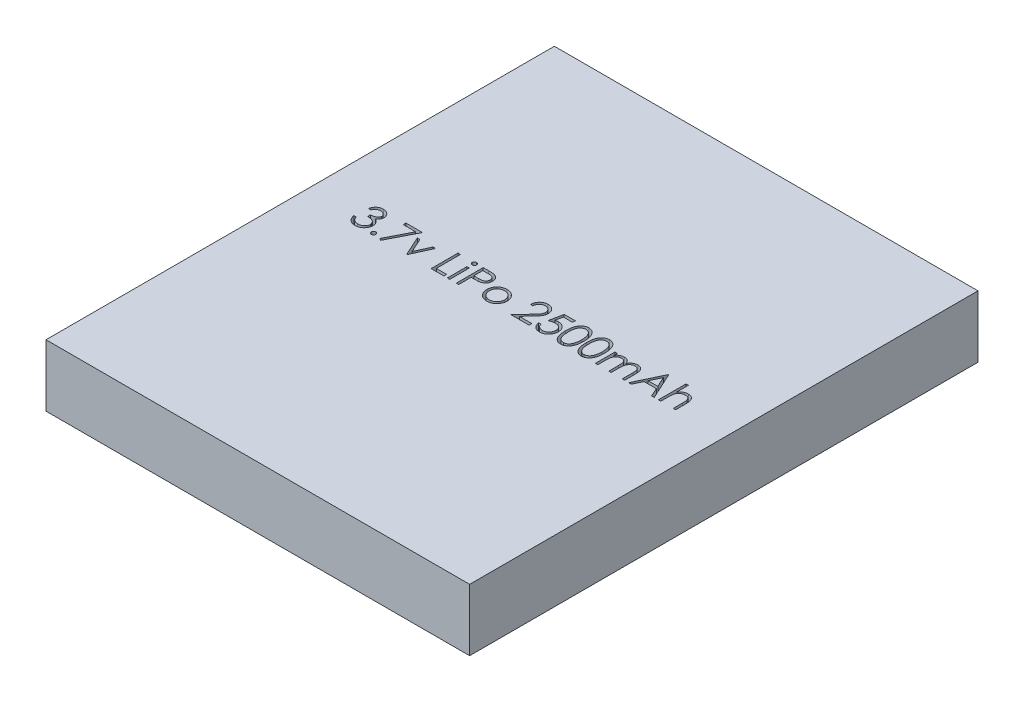
from build123d import *

# Parameters (mm, degrees)
SKETCH1_W           = 50
SKETCH1_H           = 60
BOSS_EXTRUDE1_DEPTH = 7.3
SKETCH2_W           = 0.284935897
SKETCH2_H           = 2.320192308
CUT_EXTRUDE4_DEPTH  = 1


with BuildPart() as part:
    # Sketch1 → Boss-Extrude1 (new body)
    with BuildSketch(Plane(origin=(0, 0, 0), x_dir=(1, 0, 0), z_dir=(0, 1, 0))):
        with Locations((25, 30)):
            Rectangle(SKETCH1_W, SKETCH1_H)
    extrude(amount=BOSS_EXTRUDE1_DEPTH)

    # Sketch2 → Cut-Extrude4 (cut)
    # profile 1 of 16: a face of its own
    with BuildSketch(Plane(origin=(0, 7.3, 0), x_dir=(1, 0, 0), z_dir=(0, 1, 0))):
        with BuildLine():
            Line((5.888942308, 32.442307692), (5.60400641, 32.442307692))
            add(Edge.make_bspline(
                [(5.60400641, 32.442307692), (5.611725788, 32.474268588), (5.626816541, 32.536749526), (5.658292197, 32.62601897), (5.692581521, 32.710495307), (5.733755923, 32.788596746), (5.778667436, 32.861892893), (5.830123048, 32.928721313), (5.885748796, 32.990781646), (5.947275715, 33.045857226), (6.011799572, 33.09572988), (6.080229548, 33.138252254), (6.151188888, 33.174832021), (6.22516923, 33.204967517), (6.302390828, 33.227669242), (6.382155558, 33.244140059), (6.464672447, 33.254836284), (6.520686333, 33.25588019), (6.549128606, 33.256410256)],
                knots=[0, 0, 0, 0, 1.162005537, 2.271625781, 3.343758855, 4.383309926, 5.390229558, 6.379919256, 7.361854164, 8.333198761, 9.295911338, 10.242430842, 11.177959212, 12.116337295, 13.062827104, 14.020064771, 14.994644689, 16, 16, 16, 16], degree=3))
            add(Edge.make_bspline(
                [(6.549128606, 33.256410256), (6.590569379, 33.255159098), (6.672546982, 33.252684071), (6.792982031, 33.230083118), (6.909120646, 33.194318891), (7.019691606, 33.144903438), (7.122396899, 33.083954947), (7.213779011, 33.011415507), (7.292599303, 32.928684712), (7.358724917, 32.837305886), (7.410500095, 32.73964696), (7.448678448, 32.639135389), (7.471920973, 32.5360096), (7.474933192, 32.466379783), (7.476442308, 32.431495393)],
                knots=[0, 0, 0, 0, 1.083050992, 2.142477498, 3.193116406, 4.255571735, 5.30263384, 6.308962982, 7.297363603, 8.282367274, 9.249857812, 10.179914175, 11.08814088, 12, 12, 12, 12], degree=3))
            add(Edge.make_bspline(
                [(7.476442308, 32.431495393), (7.475386764, 32.397924943), (7.47332123, 32.332232783), (7.455782797, 32.236328282), (7.426267759, 32.145939116), (7.385383045, 32.060684776), (7.332458925, 31.981105814), (7.268348693, 31.907023185), (7.192599849, 31.838108306), (7.135196813, 31.798629927), (7.10564403, 31.778305288)],
                knots=[0, 0, 0, 0, 1.024540389, 2.004866551, 2.965041327, 3.920577974, 4.882998113, 5.874504559, 6.905732034, 8, 8, 8, 8], degree=3))
            add(Edge.make_bspline(
                [(7.10564403, 31.778305288), (7.139418551, 31.761996519), (7.206335644, 31.729684128), (7.297549338, 31.666314977), (7.380351411, 31.593148148), (7.426528356, 31.53605017), (7.449729567, 31.507361779)],
                knots=[0, 0, 0, 0, 1.015518401, 2.012035669, 3.001164323, 4, 4, 4, 4], degree=3))
            add(Edge.make_bspline(
                [(7.449729567, 31.507361779), (7.465007071, 31.486445104), (7.495311898, 31.44495428), (7.532718418, 31.378246236), (7.566653829, 31.310798814), (7.593097242, 31.24080421), (7.613574964, 31.16907369), (7.62821265, 31.095484088), (7.637305978, 31.019975311), (7.638608229, 30.968891847), (7.639262821, 30.943214143)],
                knots=[0, 0, 0, 0, 1.025084078, 2.033381695, 3.024893161, 4.013698104, 4.991890475, 5.976764909, 6.982997093, 8, 8, 8, 8], degree=3))
            add(Edge.make_bspline(
                [(7.639262821, 30.943214143), (7.63763494, 30.898755324), (7.634386841, 30.810046911), (7.605354574, 30.678987699), (7.560348277, 30.550875994), (7.49643377, 30.428343818), (7.418539673, 30.313698758), (7.325868386, 30.211122392), (7.219472859, 30.122949372), (7.100813449, 30.049280094), (6.972255768, 29.990390265), (6.834755052, 29.949516727), (6.690292503, 29.922895713), (6.591225883, 29.920041054), (6.540860377, 29.918589744)],
                knots=[0, 0, 0, 0, 0.955779014, 1.907060117, 2.875433937, 3.871313158, 4.872415639, 5.851225146, 6.836215519, 7.83643374, 8.849228613, 9.86973379, 10.916971861, 12, 12, 12, 12], degree=3))
            add(Edge.make_bspline(
                [(6.540860377, 29.918589744), (6.506915726, 29.919377337), (6.440123972, 29.920927058), (6.341931655, 29.931521218), (6.248204114, 29.95087058), (6.158814621, 29.976908578), (6.073683767, 30.009921087), (5.993071329, 30.05103162), (5.916481354, 30.099392769), (5.844636591, 30.155575381), (5.777545605, 30.218423453), (5.716991348, 30.289052698), (5.66196425, 30.366157486), (5.613937713, 30.450633401), (5.570724192, 30.541388741), (5.535181467, 30.639585593), (5.50389813, 30.744346099), (5.489353487, 30.817350906), (5.481891026, 30.854807692)],
                knots=[0, 0, 0, 0, 1.048658725, 2.063410685, 3.046034179, 4.001477787, 4.936774919, 5.862367409, 6.792675028, 7.730719943, 8.675894397, 9.627829632, 10.600096036, 11.597688215, 12.626045268, 13.701542398, 14.82072376, 16, 16, 16, 16], degree=3))
            Line((5.481891026, 30.854807692), (5.766826923, 30.854807692))
            add(Edge.make_bspline(
                [(5.766826923, 30.854807692), (5.774250337, 30.830361087), (5.788689523, 30.782810317), (5.813267922, 30.714375183), (5.841269855, 30.651638949), (5.87130949, 30.594141403), (5.902858509, 30.541316295), (5.938159905, 30.494560456), (5.974599058, 30.451820237), (6.002066757, 30.427740482), (6.015509816, 30.415955529)],
                knots=[0, 0, 0, 0, 1.198163088, 2.33053128, 3.407730985, 4.417276592, 5.372219308, 6.28897303, 7.162600585, 8, 8, 8, 8], degree=3))
            add(Edge.make_bspline(
                [(6.015509816, 30.415955529), (6.03328671, 30.402250112), (6.068785626, 30.374881583), (6.126632521, 30.339955106), (6.187469953, 30.30969189), (6.252616122, 30.286574537), (6.320665235, 30.267000516), (6.392717202, 30.254191188), (6.468136349, 30.245402633), (6.519632821, 30.244627088), (6.545948518, 30.244230769)],
                knots=[0, 0, 0, 0, 0.946170439, 1.889420265, 2.845303464, 3.807233317, 4.801018734, 5.828864929, 6.890507805, 8, 8, 8, 8], degree=3))
            add(Edge.make_bspline(
                [(6.545948518, 30.244230769), (6.575660624, 30.244789483), (6.633760082, 30.245882), (6.71853699, 30.255929249), (6.799188746, 30.270561838), (6.8748199, 30.293161472), (6.946421146, 30.321084102), (7.012988785, 30.356143727), (7.075396682, 30.397277867), (7.132845499, 30.444031247), (7.18450321, 30.495213603), (7.229986911, 30.548746889), (7.268653568, 30.604405392), (7.299844386, 30.662497116), (7.324473813, 30.722781502), (7.341240717, 30.785427726), (7.352898877, 30.849923103), (7.353848304, 30.893764382), (7.354326923, 30.915865385)],
                knots=[0, 0, 0, 0, 1.217147791, 2.380027433, 3.494444702, 4.572153297, 5.609568379, 6.639424714, 7.649109417, 8.668170816, 9.669597737, 10.625200337, 11.543417969, 12.441394052, 13.322311151, 14.205496177, 15.095365482, 16, 16, 16, 16], degree=3))
            add(Edge.make_bspline(
                [(7.354326923, 30.915865385), (7.352938721, 30.945448528), (7.350169224, 31.004467612), (7.329025013, 31.091297126), (7.294246186, 31.174956936), (7.245557551, 31.254019688), (7.186288711, 31.327294971), (7.117014832, 31.392674101), (7.037160653, 31.446621969), (6.963664057, 31.483895251), (6.898562808, 31.509328883), (6.842850281, 31.526269744), (6.780478219, 31.540614988), (6.712200889, 31.55396112), (6.637503828, 31.565319772), (6.556468359, 31.574791991), (6.469078061, 31.582371206), (6.408579646, 31.585755843), (6.377403846, 31.5875)],
                knots=[0, 0, 0, 0, 1.07054697, 2.135767047, 3.216561865, 4.33974944, 5.486079747, 6.621378074, 7.775625952, 8.963672916, 9.598146892, 10.304877434, 11.070270905, 11.915000392, 12.823868403, 13.805723172, 14.86925407, 16, 16, 16, 16], degree=3))
            Line((6.377403846, 31.5875), (6.377403846, 31.913141026))
            add(Edge.make_bspline(
                [(6.377403846, 31.913141026), (6.416684189, 31.913807598), (6.493624732, 31.915113248), (6.606014566, 31.930904801), (6.713486785, 31.95274937), (6.813659615, 31.986209509), (6.904962376, 32.025071778), (6.98417373, 32.070294854), (7.050183928, 32.120563948), (7.102672185, 32.176654958), (7.142159414, 32.23681218), (7.171030866, 32.299510862), (7.188085448, 32.365300546), (7.190362074, 32.41019928), (7.19150641, 32.432767428)],
                knots=[0, 0, 0, 0, 1.321986639, 2.589447074, 3.816329219, 5.01088745, 6.139805852, 7.153945165, 8.075214402, 8.924034688, 9.728124013, 10.488707548, 11.240355623, 12, 12, 12, 12], degree=3))
            add(Edge.make_bspline(
                [(7.19150641, 32.432767428), (7.19113048, 32.449347954), (7.190382586, 32.482334124), (7.180950769, 32.53052615), (7.166777532, 32.577244866), (7.147292349, 32.622291594), (7.121211812, 32.665353913), (7.090000667, 32.706798956), (7.052836747, 32.746390099), (7.01025052, 32.78329296), (6.964519811, 32.818462197), (6.914400373, 32.848319567), (6.861403386, 32.873851159), (6.805470178, 32.894905493), (6.746419233, 32.910743562), (6.684527998, 32.922115361), (6.619678457, 32.929225234), (6.575435528, 32.930248868), (6.552944712, 32.930769231)],
                knots=[0, 0, 0, 0, 0.884392785, 1.759457502, 2.611959086, 3.489218968, 4.37281399, 5.2945488, 6.255912374, 7.266815255, 8.301784654, 9.332968512, 10.37626691, 11.440494194, 12.520033166, 13.637162961, 14.798855837, 16, 16, 16, 16], degree=3))
            add(Edge.make_bspline(
                [(6.552944712, 32.930769231), (6.516793556, 32.929507067), (6.44618194, 32.927041767), (6.34438698, 32.905449033), (6.249754441, 32.870997486), (6.177420079, 32.829873961), (6.124005172, 32.789278925), (6.085835378, 32.753825617), (6.048351773, 32.714425841), (6.014020337, 32.668652887), (5.979300373, 32.619606584), (5.947691378, 32.564793673), (5.9169758, 32.505643972), (5.898467772, 32.463828647), (5.888942308, 32.442307692)],
                knots=[0, 0, 0, 0, 1.472543308, 2.876219568, 4.221790263, 5.565193594, 6.249813518, 6.953379497, 7.687249741, 8.463570142, 9.283606569, 10.136032583, 11.040678096, 12, 12, 12, 12], degree=3))
        make_face()
    # profile 2 of 16: a face of its own
    with BuildSketch(Plane(origin=(0, 7.3, 0), x_dir=(1, 0, 0), z_dir=(0, 1, 0))):
        with BuildLine():
            add(Edge.make_bspline(
                [(8.433012821, 30.488461538), (8.450693227, 30.487410916), (8.485353598, 30.485351293), (8.535463378, 30.471221025), (8.580815677, 30.446130668), (8.621212785, 30.412690862), (8.654510803, 30.372145511), (8.680495322, 30.327154936), (8.694502502, 30.276625635), (8.696547122, 30.241764429), (8.697596154, 30.223878205)],
                knots=[0, 0, 0, 0, 1.020151414, 1.999887582, 2.974338812, 3.990962822, 5.007586832, 5.987933904, 6.967670073, 8, 8, 8, 8], degree=3))
            add(Edge.make_bspline(
                [(8.697596154, 30.223878205), (8.696511573, 30.206421756), (8.694372796, 30.171997895), (8.68052743, 30.121849711), (8.65431277, 30.076831019), (8.621442455, 30.035735508), (8.58080569, 30.002224861), (8.535356158, 29.97734797), (8.485471231, 29.962205959), (8.450712852, 29.960277104), (8.433012821, 29.959294872)],
                knots=[0, 0, 0, 0, 1.009421747, 1.99056486, 2.972319754, 3.999869655, 5.017953583, 5.993804169, 6.978383603, 8, 8, 8, 8], degree=3))
            add(Edge.make_bspline(
                [(8.433012821, 29.959294872), (8.415300035, 29.960241564), (8.380720037, 29.962089754), (8.331021314, 29.977658871), (8.285294992, 30.001991581), (8.244666139, 30.035797992), (8.211520526, 30.076619551), (8.186460357, 30.122159752), (8.171410722, 30.171854341), (8.169431452, 30.206393482), (8.168429487, 30.223878205)],
                knots=[0, 0, 0, 0, 1.022052826, 1.995314843, 2.982371812, 4.00089066, 5.028879526, 6.005146991, 6.990147033, 8, 8, 8, 8], degree=3))
            add(Edge.make_bspline(
                [(8.168429487, 30.223878205), (8.169392963, 30.241793714), (8.171274031, 30.276771546), (8.186491951, 30.326845022), (8.211326087, 30.372354963), (8.244895266, 30.412629004), (8.285285163, 30.4463632), (8.330911007, 30.470914834), (8.380839732, 30.485465779), (8.415320177, 30.487445633), (8.433012821, 30.488461538)],
                knots=[0, 0, 0, 0, 1.032775665, 2.016367738, 2.991239715, 4.008302682, 5.025365648, 6.011011707, 6.979408107, 8, 8, 8, 8], degree=3))
        make_face()
    # profile 3 of 16: a face of its own
    with BuildSketch(Plane(origin=(0, 7.3, 0), x_dir=(1, 0, 0), z_dir=(0, 1, 0))):
        Polygon((9.308173077, 33.175), (11.262019231, 33.175), (9.593108974, 29.918589744), (9.346970152, 30.054061498), (10.779917869, 32.849358974), (9.308173077, 32.849358974), align=None)
    # profile 4 of 16: a face of its own
    with BuildSketch(Plane(origin=(0, 7.3, 0), x_dir=(1, 0, 0), z_dir=(0, 1, 0))):
        Polygon((11.50625, 32.320192308), (11.81471855, 32.320192308), (12.584935897, 30.630929487), (13.355153245, 32.320192308), (13.663621795, 32.320192308), (12.605288462, 30), (12.564583333, 30), align=None)
    # profile 5 of 16: a face of its own
    with BuildSketch(Plane(origin=(0, 7.3, 0), x_dir=(1, 0, 0), z_dir=(0, 1, 0))):
        Polygon((15.454647436, 33.175), (15.739583333, 33.175), (15.739583333, 30.325641026), (16.960737179, 30.325641026), (16.960737179, 30), (15.454647436, 30), align=None)
    # profile 6 of 16: a face of its own
    with BuildSketch(Plane(origin=(0, 7.3, 0), x_dir=(1, 0, 0), z_dir=(0, 1, 0))):
        with BuildLine():
            add(Edge.make_bspline(
                [(17.508984375, 33.297115385), (17.526665783, 33.296295189), (17.561289375, 33.294689089), (17.611357554, 33.280935463), (17.656947844, 33.257622177), (17.697386216, 33.226344181), (17.732086141, 33.189560043), (17.756380071, 33.146687593), (17.771994174, 33.100370114), (17.77387972, 33.06806214), (17.774839744, 33.05161258)],
                knots=[0, 0, 0, 0, 1.055194115, 2.066272739, 3.074728998, 4.095836921, 5.109056067, 6.073838105, 7.019297344, 8, 8, 8, 8], degree=3))
            add(Edge.make_bspline(
                [(17.774839744, 33.05161258), (17.77385807, 33.03559003), (17.771917418, 33.003915346), (17.756392132, 32.958400839), (17.731879102, 32.916124096), (17.697408466, 32.879411381), (17.656941947, 32.848150675), (17.61135912, 32.824832805), (17.561288963, 32.811080395), (17.526665644, 32.809474127), (17.508984375, 32.808653846)],
                knots=[0, 0, 0, 0, 0.96129708, 1.900370562, 2.859976407, 3.87933698, 4.906634145, 5.921202961, 6.938410037, 8, 8, 8, 8], degree=3))
            add(Edge.make_bspline(
                [(17.508984375, 32.808653846), (17.491505297, 32.809442807), (17.457484555, 32.810978415), (17.408166062, 32.825102646), (17.362964504, 32.848158655), (17.322447265, 32.879206694), (17.288674161, 32.916349565), (17.264092109, 32.958375039), (17.248602679, 33.003921915), (17.246657195, 33.035592237), (17.245673077, 33.05161258)],
                knots=[0, 0, 0, 0, 1.054934014, 2.053291228, 3.073705704, 4.106921865, 5.123545215, 6.088680038, 7.033164197, 8, 8, 8, 8], degree=3))
            add(Edge.make_bspline(
                [(17.245673077, 33.05161258), (17.246635634, 33.068059851), (17.248526157, 33.100363328), (17.26410372, 33.146713822), (17.288469402, 33.189332756), (17.322469628, 33.226548745), (17.362958552, 33.257614247), (17.4081676, 33.280665637), (17.457484149, 33.294791066), (17.491505159, 33.296326509), (17.508984375, 33.297115385)],
                knots=[0, 0, 0, 0, 0.98631895, 1.937192651, 2.907499808, 3.917963147, 4.944918757, 5.95915025, 6.951458133, 8, 8, 8, 8], degree=3))
        make_face()
    # profile 7 of 16: a face of its own
    with BuildSketch(Plane(origin=(0, 7.3, 0), x_dir=(1, 0, 0), z_dir=(0, 1, 0))):
        with Locations((17.51025641, 31.160096154)):
            Rectangle(SKETCH2_W, SKETCH2_H)
    # profile 8 of 16: a face of its own
    with BuildSketch(Plane(origin=(0, 7.3, 0), x_dir=(1, 0, 0), z_dir=(0, 1, 0))):
        with BuildLine():
            Line((18.426121795, 33.175), (19.048783053, 33.175))
            add(Edge.make_bspline(
                [(19.048783053, 33.175), (19.091610089, 33.174952923), (19.173668593, 33.17486272), (19.291338679, 33.172127915), (19.398208935, 33.16847513), (19.494048924, 33.163411556), (19.579153527, 33.157427506), (19.653137649, 33.149034585), (19.716582818, 33.140271317), (19.754597954, 33.131361898), (19.771935096, 33.127298678)],
                knots=[0, 0, 0, 0, 1.415646017, 2.712440637, 3.8905458, 4.950247383, 5.884950622, 6.709939814, 7.411656543, 8, 8, 8, 8], degree=3))
            add(Edge.make_bspline(
                [(19.771935096, 33.127298678), (19.793882088, 33.121291623), (19.837258917, 33.109419063), (19.899762006, 33.085639471), (19.959228709, 33.057443507), (20.015863051, 33.025308933), (20.068969083, 32.987857028), (20.119339135, 32.946605961), (20.166528688, 32.900603324), (20.21027238, 32.850365081), (20.250445017, 32.796734605), (20.285034087, 32.738911296), (20.313996643, 32.677868471), (20.338837182, 32.613648589), (20.356715566, 32.545712367), (20.370183825, 32.474531849), (20.378732401, 32.400114666), (20.379551154, 32.349260357), (20.379967949, 32.323372396)],
                knots=[0, 0, 0, 0, 0.999701418, 1.975846123, 2.934577507, 3.890451536, 4.834027766, 5.787354733, 6.749476667, 7.726910423, 8.712836071, 9.690891519, 10.682875813, 11.679750201, 12.712814741, 13.765529915, 14.8625177, 16, 16, 16, 16], degree=3))
            add(Edge.make_bspline(
                [(20.379967949, 32.323372396), (20.379585656, 32.297266841), (20.378837675, 32.24618956), (20.369860331, 32.171465674), (20.357767943, 32.100056849), (20.339174188, 32.032121418), (20.314821327, 31.968062827), (20.286253537, 31.906902138), (20.251797048, 31.849679864), (20.212204953, 31.796188264), (20.168161721, 31.74637713), (20.119853698, 31.700607423), (20.067475912, 31.659147059), (20.01119482, 31.62190309), (19.950461743, 31.589739179), (19.886197789, 31.560930767), (19.817844379, 31.536736305), (19.77054367, 31.524009035), (19.746494391, 31.517538061)],
                knots=[0, 0, 0, 0, 1.121902311, 2.195077645, 3.232258892, 4.234102512, 5.217864754, 6.176164875, 7.132989551, 8.084763148, 9.034132444, 9.988522005, 10.94243251, 11.903244335, 12.886203696, 13.894208494, 14.929344452, 16, 16, 16, 16], degree=3))
            add(Edge.make_bspline(
                [(19.746494391, 31.517538061), (19.726603167, 31.513308071), (19.683010392, 31.504037802), (19.611216637, 31.493688702), (19.527627608, 31.484855307), (19.432357397, 31.478232132), (19.325491519, 31.472562155), (19.206972164, 31.468055384), (19.07656668, 31.465579017), (18.985606337, 31.465451298), (18.938115986, 31.465384615)],
                knots=[0, 0, 0, 0, 0.601384939, 1.31797006, 2.144135048, 3.087295005, 4.142315834, 5.309527816, 6.595305764, 8, 8, 8, 8], degree=3))
            Line((18.938115986, 31.465384615), (18.711057692, 31.465384615))
            Line((18.711057692, 31.465384615), (18.711057692, 30))
            Line((18.711057692, 30), (18.426121795, 30))
            Line((18.426121795, 30), (18.426121795, 33.175))
        make_face()
        with BuildLine():
            Line((18.711057692, 32.849358974), (18.711057692, 31.791025641))
            Line((18.711057692, 31.791025641), (19.266937099, 31.784029447))
            add(Edge.make_bspline(
                [(19.266937099, 31.784029447), (19.294078746, 31.784015419), (19.346475136, 31.783988339), (19.42216371, 31.787603506), (19.492384992, 31.791776847), (19.556923286, 31.797887291), (19.615807683, 31.806524432), (19.66913637, 31.815243652), (19.716495834, 31.827857802), (19.771921538, 31.8448423), (19.833682861, 31.873809745), (19.900872708, 31.915855716), (19.957814597, 31.969450359), (20.007089052, 32.029709891), (20.046192242, 32.096746959), (20.074818035, 32.16847378), (20.091637513, 32.244154758), (20.093892846, 32.295941855), (20.095032051, 32.322100361)],
                knots=[0, 0, 0, 0, 1.160613943, 2.240541288, 3.23993089, 4.169200891, 5.011653406, 5.7853311, 6.478053781, 7.106038997, 8.262395093, 9.384106736, 10.481365981, 11.59014053, 12.70357646, 13.786202915, 14.881775077, 16, 16, 16, 16], degree=3))
            add(Edge.make_bspline(
                [(20.095032051, 32.322100361), (20.093886651, 32.347626012), (20.091609736, 32.398367848), (20.074686203, 32.472734295), (20.046247896, 32.543705256), (20.006826557, 32.609902269), (19.958982818, 32.669944969), (19.903375557, 32.722103078), (19.840135669, 32.764032765), (19.78130906, 32.791095813), (19.729056555, 32.80761967), (19.68367042, 32.819181061), (19.632425309, 32.82841179), (19.575304537, 32.835886196), (19.512750838, 32.842284693), (19.444226795, 32.846626258), (19.36999199, 32.849167579), (19.318456687, 32.849293631), (19.291741787, 32.849358974)],
                knots=[0, 0, 0, 0, 1.120700087, 2.227813068, 3.331159281, 4.466773991, 5.599788987, 6.693661531, 7.80175334, 8.91857717, 9.525282508, 10.207424825, 10.974604443, 11.810962634, 12.737642355, 13.736264703, 14.826523623, 16, 16, 16, 16], degree=3))
            Line((19.291741787, 32.849358974), (18.711057692, 32.849358974))
        make_face(mode=Mode.SUBTRACT)
    # profile 9 of 16: a face of its own
    with BuildSketch(Plane(origin=(0, 7.3, 0), x_dir=(1, 0, 0), z_dir=(0, 1, 0))):
        with BuildLine():
            add(Edge.make_bspline(
                [(22.070502804, 32.360897436), (22.114037745, 32.359970435), (22.199399124, 32.358152812), (22.324410563, 32.338726379), (22.443740793, 32.309019841), (22.557846839, 32.267952067), (22.665267336, 32.212904869), (22.767566964, 32.147219298), (22.864465251, 32.069402231), (22.922543285, 32.009205983), (22.952023237, 31.978650841)],
                knots=[0, 0, 0, 0, 1.054011418, 2.066658804, 3.057071809, 4.030435133, 4.997543892, 5.974964718, 6.972108034, 8, 8, 8, 8], degree=3))
            add(Edge.make_bspline(
                [(22.952023237, 31.978650841), (22.977406867, 31.949428154), (23.027682883, 31.89154832), (23.092149642, 31.797699299), (23.147686343, 31.700507922), (23.192193458, 31.598683562), (23.227286301, 31.49311511), (23.252201611, 31.383439714), (23.267021545, 31.269899585), (23.269019951, 31.19278896), (23.270032051, 31.153735978)],
                knots=[0, 0, 0, 0, 1.025258237, 2.030674902, 3.01204498, 3.988269485, 4.97094183, 5.956517959, 6.965070386, 8, 8, 8, 8], degree=3))
            add(Edge.make_bspline(
                [(23.270032051, 31.153735978), (23.269141838, 31.11445664), (23.267382735, 31.036838836), (23.250742455, 30.922521268), (23.224860684, 30.811673108), (23.187820374, 30.704758435), (23.140324089, 30.601450442), (23.082366108, 30.502200351), (23.013539713, 30.406812344), (22.935521801, 30.316096391), (22.849296171, 30.232488468), (22.755755093, 30.159619252), (22.656736791, 30.097188297), (22.550924606, 30.046899549), (22.439284815, 30.007248606), (22.321576617, 29.979399306), (22.197982875, 29.962561207), (22.113593896, 29.960398966), (22.070502804, 29.959294872)],
                knots=[0, 0, 0, 0, 0.998656419, 1.973391657, 2.932242238, 3.890759089, 4.846373663, 5.82037756, 6.809684879, 7.83454468, 8.860553229, 9.859544525, 10.845671541, 11.83227036, 12.833544569, 13.85385346, 14.904124723, 16, 16, 16, 16], degree=3))
            add(Edge.make_bspline(
                [(22.070502804, 29.959294872), (22.027200595, 29.960402671), (21.942391029, 29.962572352), (21.818361031, 29.979333887), (21.700441877, 30.007235772), (21.588655934, 30.047029854), (21.482388823, 30.097189905), (21.382796786, 30.159430509), (21.28917972, 30.232510078), (21.202935848, 30.316090535), (21.124922828, 30.406813853), (21.05609517, 30.502199959), (20.998137517, 30.601450544), (20.950641147, 30.704758408), (20.913600859, 30.811673115), (20.887719082, 30.922521266), (20.871078803, 31.036838836), (20.8693197, 31.11445664), (20.868429487, 31.153735978)],
                knots=[0, 0, 0, 0, 1.099876186, 2.154163076, 3.173186993, 4.173200201, 5.163417411, 6.152872554, 7.150605724, 8.17532212, 9.198891216, 10.186952605, 11.159729845, 12.11414092, 13.071450619, 14.029093627, 15.002601286, 16, 16, 16, 16], degree=3))
            add(Edge.make_bspline(
                [(20.868429487, 31.153735978), (20.86944849, 31.192576701), (20.871465941, 31.269474659), (20.886270974, 31.38280135), (20.911089093, 31.492291124), (20.946224003, 31.597452092), (20.991141355, 31.698830237), (21.045897666, 31.796261763), (21.111022025, 31.88968641), (21.161098081, 31.94749144), (21.186438301, 31.976742788)],
                knots=[0, 0, 0, 0, 1.031353054, 2.041901799, 3.029428768, 4.008703097, 4.981709435, 5.96992636, 6.972712378, 8, 8, 8, 8], degree=3))
            add(Edge.make_bspline(
                [(21.186438301, 31.976742788), (21.215873809, 32.007562912), (21.273763914, 32.068176108), (21.371144546, 32.145766326), (21.473192512, 32.212818764), (21.581800123, 32.266772189), (21.69581243, 32.309261415), (21.815754172, 32.33880299), (21.941189818, 32.358082819), (22.026968903, 32.35994988), (22.070502804, 32.360897436)],
                knots=[0, 0, 0, 0, 1.027980169, 2.021703884, 2.998553061, 3.971491411, 4.943284454, 5.930300938, 6.949603206, 8, 8, 8, 8], degree=3))
        make_face()
        with BuildLine():
            add(Edge.make_bspline(
                [(22.069230769, 32.075961538), (22.038444508, 32.075086516), (21.977666727, 32.07335906), (21.888204675, 32.060220089), (21.802080392, 32.039403425), (21.719130484, 32.009826888), (21.639634677, 31.971637172), (21.563516862, 31.924730303), (21.490553149, 31.869727549), (21.422170848, 31.806714983), (21.359412608, 31.737881895), (21.304550444, 31.664540884), (21.257900526, 31.587881555), (21.219038382, 31.507824192), (21.190094004, 31.423557503), (21.169072762, 31.336035787), (21.155946187, 31.245080731), (21.154234972, 31.18324895), (21.153365385, 31.151827925)],
                knots=[0, 0, 0, 0, 1.021534396, 2.016698045, 2.994645724, 3.958388632, 4.93408049, 5.916473867, 6.921342795, 7.962252576, 8.998418191, 10.008913653, 10.997312074, 11.973003931, 12.956656626, 13.948281152, 14.957379055, 16, 16, 16, 16], degree=3))
            add(Edge.make_bspline(
                [(21.153365385, 31.151827925), (21.154823003, 31.111231443), (21.157716104, 31.030655018), (21.181243068, 30.911990642), (21.220600622, 30.798069962), (21.273747654, 30.689560812), (21.340337581, 30.589165246), (21.418793706, 30.499656113), (21.508274006, 30.422380413), (21.607711831, 30.358262789), (21.715076105, 30.307317867), (21.828701482, 30.271214511), (21.947211254, 30.24774519), (22.028201632, 30.245412495), (22.069230769, 30.244230769)],
                knots=[0, 0, 0, 0, 1.016792936, 2.018143844, 3.017858371, 4.030088057, 5.03801393, 6.028138512, 7.003788237, 7.991172063, 8.984598303, 9.972568034, 10.972917682, 12, 12, 12, 12], degree=3))
            add(Edge.make_bspline(
                [(22.069230769, 30.244230769), (22.110257547, 30.245419381), (22.191243266, 30.247765666), (22.309588376, 30.27109631), (22.422903194, 30.307476059), (22.530155952, 30.358205493), (22.629548514, 30.422623898), (22.71967236, 30.499219754), (22.7974586, 30.589402319), (22.863982656, 30.689693792), (22.918000058, 30.79790174), (22.957173391, 30.912011668), (22.980756916, 31.030649663), (22.983642382, 31.111229649), (22.985096154, 31.151827925)],
                knots=[0, 0, 0, 0, 1.02726834, 2.027799167, 3.010890988, 4.004497153, 4.992059811, 5.971914811, 6.958719428, 7.966827853, 8.981595046, 9.981490638, 10.983022906, 12, 12, 12, 12], degree=3))
            add(Edge.make_bspline(
                [(22.985096154, 31.151827925), (22.984226866, 31.183249138), (22.98251624, 31.245081288), (22.96938538, 31.336033657), (22.948379997, 31.423565319), (22.919377173, 31.507795351), (22.880683889, 31.588088837), (22.83313437, 31.664315804), (22.778496225, 31.738135956), (22.714980694, 31.806492473), (22.646669773, 31.869752114), (22.573676488, 31.924751631), (22.497671543, 31.971431021), (22.418406686, 32.01015354), (22.335446143, 32.039134341), (22.249442533, 32.060340285), (22.160362184, 32.073303535), (22.099802194, 32.075069871), (22.069230769, 32.075961538)],
                knots=[0, 0, 0, 0, 1.042956736, 2.052379634, 3.044323526, 4.02829302, 5.004299113, 5.996692471, 7.007513377, 8.048758398, 9.090003419, 10.095195979, 11.07790575, 12.047570684, 13.018257071, 13.989683339, 14.985167495, 16, 16, 16, 16], degree=3))
        make_face(mode=Mode.SUBTRACT)
    # profile 10 of 16: a face of its own
    with BuildSketch(Plane(origin=(0, 7.3, 0), x_dir=(1, 0, 0), z_dir=(0, 1, 0))):
        with BuildLine():
            Line((25.264583333, 32.198076923), (24.979647436, 32.198076923))
            add(Edge.make_bspline(
                [(24.979647436, 32.198076923), (24.981504496, 32.235878371), (24.985151713, 32.310119409), (25.002231661, 32.418363239), (25.026670885, 32.521827235), (25.061225276, 32.619680657), (25.104138828, 32.712788718), (25.155601067, 32.800781589), (25.216555488, 32.883323596), (25.285685883, 32.959649547), (25.360768863, 33.0296697), (25.441782108, 33.090135528), (25.526912954, 33.141223701), (25.615903123, 33.183933113), (25.709756634, 33.215991402), (25.807621798, 33.239778175), (25.909928586, 33.254089574), (25.979633463, 33.255627894), (26.015084135, 33.256410256)],
                knots=[0, 0, 0, 0, 1.10065271, 2.161652631, 3.183658789, 4.190468796, 5.17591951, 6.163126047, 7.15150782, 8.156236427, 9.156009102, 10.134482811, 11.092018607, 12.041330605, 13.001268258, 13.972401359, 14.968799086, 16, 16, 16, 16], degree=3))
            add(Edge.make_bspline(
                [(26.015084135, 33.256410256), (26.04989853, 33.255595228), (26.118307574, 33.253993726), (26.218149545, 33.240240507), (26.313197519, 33.218699863), (26.403265707, 33.188478021), (26.487635494, 33.147852148), (26.566940685, 33.099050095), (26.64212542, 33.042607819), (26.709804431, 32.976156146), (26.771951046, 32.905215411), (26.825565234, 32.829479956), (26.871478604, 32.751257675), (26.909748857, 32.669952092), (26.937921211, 32.584797659), (26.959310014, 32.497034125), (26.971399882, 32.405753047), (26.973255374, 32.343970671), (26.974198718, 32.312560096)],
                knots=[0, 0, 0, 0, 1.111607364, 2.184268762, 3.212621178, 4.221274766, 5.211760367, 6.196651075, 7.1921475, 8.207485113, 9.220403448, 10.201281604, 11.166441695, 12.114753415, 13.065576456, 14.026450734, 14.996634279, 16, 16, 16, 16], degree=3))
            add(Edge.make_bspline(
                [(26.974198718, 32.312560096), (26.972662687, 32.268338846), (26.969617579, 32.180672367), (26.943569538, 32.051844598), (26.902887345, 31.927027711), (26.853904029, 31.826573158), (26.80448974, 31.745625632), (26.759960358, 31.678979021), (26.707831566, 31.60721906), (26.647344642, 31.530586047), (26.579750823, 31.448479726), (26.50443786, 31.360949697), (26.420868701, 31.268900306), (26.362214204, 31.206030225), (26.331820913, 31.173452524)],
                knots=[0, 0, 0, 0, 1.184426356, 2.348067706, 3.509069118, 4.696110526, 5.333549288, 6.050745305, 6.844228056, 7.710549037, 8.667450064, 9.695053472, 10.805634456, 12, 12, 12, 12], degree=3))
            Line((26.331820913, 31.173452524), (25.537434896, 30.325641026))
            Line((25.537434896, 30.325641026), (27.014903846, 30.325641026))
            Line((27.014903846, 30.325641026), (27.014903846, 30))
            Line((27.014903846, 30), (24.857532051, 30))
            Line((24.857532051, 30), (26.088862179, 31.31401242))
            add(Edge.make_bspline(
                [(26.088862179, 31.31401242), (26.118841334, 31.345307312), (26.176425154, 31.405418396), (26.257870778, 31.493178081), (26.33102186, 31.574593736), (26.396351923, 31.649511533), (26.452443746, 31.719027313), (26.502220699, 31.780889651), (26.542103771, 31.837816902), (26.585388451, 31.903803031), (26.627311135, 31.98436849), (26.663335915, 32.082824051), (26.685302241, 32.18417663), (26.687937342, 32.252667764), (26.689262821, 32.287119391)],
                knots=[0, 0, 0, 0, 1.329631726, 2.553950428, 3.673215718, 4.687767853, 5.603093632, 6.413772471, 7.123043292, 7.734684054, 8.834405432, 9.900288307, 10.943827018, 12, 12, 12, 12], degree=3))
            add(Edge.make_bspline(
                [(26.689262821, 32.287119391), (26.688686111, 32.308783231), (26.687549529, 32.3514785), (26.677518617, 32.414076581), (26.662359801, 32.474460376), (26.640638031, 32.532815624), (26.611966203, 32.588555608), (26.577065351, 32.641748179), (26.536797222, 32.693173169), (26.490214285, 32.741390804), (26.439040978, 32.785551612), (26.38498048, 32.824671318), (26.327785028, 32.85736394), (26.267695774, 32.884164112), (26.204880241, 32.905187494), (26.139216937, 32.919754919), (26.070887293, 32.928901173), (26.024229765, 32.930138671), (26.000455729, 32.930769231)],
                knots=[0, 0, 0, 0, 0.991446411, 1.95395049, 2.89581595, 3.838931463, 4.798493298, 5.75982156, 6.748411868, 7.785213223, 8.824556874, 9.840280684, 10.836137867, 11.835679398, 12.848801643, 13.863922112, 14.911575587, 16, 16, 16, 16], degree=3))
            add(Edge.make_bspline(
                [(26.000455729, 32.930769231), (25.975626474, 32.930120594), (25.926865916, 32.92884678), (25.855275079, 32.91993622), (25.786980123, 32.904563922), (25.721809254, 32.883539367), (25.659652201, 32.856816255), (25.600811247, 32.823531601), (25.545418483, 32.783813718), (25.49336978, 32.738782642), (25.445414599, 32.688647032), (25.403280647, 32.632757994), (25.366465149, 32.572135982), (25.334343916, 32.506944568), (25.308258397, 32.436592211), (25.28832561, 32.36132865), (25.272553256, 32.281480682), (25.267284098, 32.226339927), (25.264583333, 32.198076923)],
                knots=[0, 0, 0, 0, 1.031018746, 2.02475058, 2.990194455, 3.934040569, 4.864654155, 5.795059489, 6.735614925, 7.690564532, 8.649604399, 9.611025574, 10.590972636, 11.591080095, 12.624614302, 13.701020113, 14.821632451, 16, 16, 16, 16], degree=3))
        make_face()
    # profile 11 of 16: a face of its own
    with BuildSketch(Plane(origin=(0, 7.3, 0), x_dir=(1, 0, 0), z_dir=(0, 1, 0))):
        with BuildLine():
            Line((29.294391026, 33.175), (29.294391026, 32.849358974))
            Line((29.294391026, 32.849358974), (28.214433093, 32.849358974))
            Line((28.214433093, 32.849358974), (28.043344351, 32.014267829))
            add(Edge.make_bspline(
                [(28.043344351, 32.014267829), (28.076959323, 32.023548147), (28.142083014, 32.041527295), (28.238203745, 32.061489672), (28.329455244, 32.073523325), (28.38866933, 32.075166443), (28.417322716, 32.075961538)],
                knots=[0, 0, 0, 0, 1.100273476, 2.13160584, 3.095893838, 4, 4, 4, 4], degree=3))
            add(Edge.make_bspline(
                [(28.417322716, 32.075961538), (28.452777252, 32.075194154), (28.522489726, 32.073685284), (28.624487914, 32.059196535), (28.721854181, 32.036391041), (28.814384903, 32.004531711), (28.90225126, 31.963792167), (28.984644833, 31.912901507), (29.062802369, 31.853453414), (29.135321722, 31.785104724), (29.20111163, 31.709882972), (29.258956492, 31.629004046), (29.308089699, 31.543253952), (29.347605526, 31.4518134), (29.379159887, 31.355693311), (29.400162054, 31.253882325), (29.414147211, 31.147340102), (29.415709661, 31.074492385), (29.41650641, 31.037344752)],
                knots=[0, 0, 0, 0, 1.052922333, 2.070308379, 3.05430497, 4.020497103, 4.973039431, 5.925935799, 6.892292201, 7.88610001, 8.88166317, 9.857072816, 10.836096531, 11.812156883, 12.81219415, 13.836441305, 14.89672472, 16, 16, 16, 16], degree=3))
            add(Edge.make_bspline(
                [(29.41650641, 31.037344752), (29.415903092, 31.011471023), (29.414704609, 30.960073227), (29.40860989, 30.883742417), (29.396875348, 30.809027561), (29.381120341, 30.735918748), (29.360671147, 30.664554389), (29.335916077, 30.594730218), (29.305621109, 30.526880824), (29.272391219, 30.460364216), (29.234974771, 30.396684142), (29.193447125, 30.337131132), (29.149572715, 30.28081182), (29.102363744, 30.228330219), (29.051381413, 30.180031196), (28.997243157, 30.135628112), (28.940380976, 30.094370048), (28.879915149, 30.057931757), (28.81719304, 30.024401075), (28.751308871, 29.996893295), (28.683762379, 29.972300173), (28.613581384, 29.952697244), (28.540924854, 29.937336998), (28.465673022, 29.926904311), (28.388220557, 29.919305685), (28.335719653, 29.918830018), (28.30919972, 29.918589744)],
                knots=[0, 0, 0, 0, 1.056347294, 2.098418968, 3.122841568, 4.141288669, 5.149314143, 6.15115421, 7.162517403, 8.180376062, 9.185164535, 10.17417709, 11.141909838, 12.097768115, 13.052685741, 14.0056014, 14.954263652, 15.917497458, 16.885230207, 17.854509472, 18.828990115, 19.81800267, 20.826176721, 21.857883937, 22.917946725, 24, 24, 24, 24], degree=3))
            add(Edge.make_bspline(
                [(28.30919972, 29.918589744), (28.277563856, 29.919216432), (28.215324031, 29.920449368), (28.124137516, 29.933347566), (28.036403552, 29.951820547), (27.952828389, 29.97961202), (27.872663029, 30.014434781), (27.796986706, 30.058445879), (27.723865752, 30.10831978), (27.65627269, 30.167175529), (27.593538216, 30.231506183), (27.537380168, 30.301317758), (27.487366138, 30.375458038), (27.444297039, 30.454287077), (27.407559548, 30.537597745), (27.378698809, 30.625702181), (27.355404873, 30.718140042), (27.345550198, 30.781779298), (27.340544872, 30.814102564)],
                knots=[0, 0, 0, 0, 1.0467383, 2.05933395, 3.04377827, 4.011590433, 4.970194871, 5.932262533, 6.905835911, 7.896367577, 8.894135286, 9.877477877, 10.858688626, 11.851381753, 12.8477658, 13.868841284, 14.917554742, 16, 16, 16, 16], degree=3))
            Line((27.340544872, 30.814102564), (27.625480769, 30.814102564))
            add(Edge.make_bspline(
                [(27.625480769, 30.814102564), (27.632491675, 30.783825354), (27.645967025, 30.725630874), (27.675545097, 30.643868872), (27.711709141, 30.571007861), (27.754711657, 30.506084025), (27.806010613, 30.449470149), (27.864548024, 30.399017529), (27.930177744, 30.353501518), (28.003105888, 30.315562294), (28.080043467, 30.283205639), (28.160568008, 30.261659459), (28.242486951, 30.246509363), (28.297893758, 30.244992837), (28.325736178, 30.244230769)],
                knots=[0, 0, 0, 0, 1.136247022, 2.183929868, 3.172523383, 4.106158343, 5.02341133, 5.958108904, 6.928429099, 7.938127109, 8.96079061, 9.975095812, 10.982467395, 12, 12, 12, 12], degree=3))
            add(Edge.make_bspline(
                [(28.325736178, 30.244230769), (28.352912767, 30.244975332), (28.406423693, 30.246441382), (28.485174022, 30.257725343), (28.561204272, 30.275103997), (28.633764231, 30.301111651), (28.704123628, 30.332720789), (28.770502691, 30.37328375), (28.83482173, 30.419965339), (28.895081537, 30.473447424), (28.950271608, 30.532384219), (28.99903609, 30.59541014), (29.039655147, 30.662644708), (29.073885374, 30.732923925), (29.09987801, 30.807018045), (29.1184209, 30.884579825), (29.129309389, 30.965800843), (29.130807245, 31.021199431), (29.131570513, 31.049429087)],
                knots=[0, 0, 0, 0, 1.027316725, 2.022795036, 3.002884548, 3.971462791, 4.93288096, 5.914575861, 6.907176829, 7.935150275, 8.956128384, 9.956726525, 10.942570165, 11.921478529, 12.907843606, 13.90538589, 14.932640048, 16, 16, 16, 16], degree=3))
            add(Edge.make_bspline(
                [(29.131570513, 31.049429087), (29.130973178, 31.074897804), (29.12980398, 31.124749195), (29.120251248, 31.197682761), (29.103635137, 31.266691878), (29.080572046, 31.33210979), (29.051289921, 31.393998198), (29.015506481, 31.452420974), (28.972550184, 31.506608094), (28.923481114, 31.556584911), (28.869725605, 31.602708476), (28.810358782, 31.642027754), (28.746622991, 31.675105737), (28.67928614, 31.703651707), (28.606746553, 31.724153812), (28.530440751, 31.739546108), (28.449544738, 31.748450044), (28.394235613, 31.749685471), (28.365805288, 31.750320513)],
                knots=[0, 0, 0, 0, 1.045622112, 2.046656509, 3.013763289, 3.955457236, 4.890082067, 5.820317437, 6.762574623, 7.722996705, 8.69280354, 9.665887285, 10.63943826, 11.638615906, 12.663482002, 13.728887084, 14.832589034, 16, 16, 16, 16], degree=3))
            add(Edge.make_bspline(
                [(28.365805288, 31.750320513), (28.341195474, 31.749793834), (28.290382452, 31.748706375), (28.212438174, 31.740699481), (28.130530682, 31.727782407), (28.044973961, 31.710014883), (27.955511072, 31.686763834), (27.862330808, 31.658901395), (27.765237252, 31.625589296), (27.699816173, 31.600432216), (27.666185897, 31.5875)],
                knots=[0, 0, 0, 0, 0.817624296, 1.688186739, 2.600797293, 3.572016777, 4.590301741, 5.671205678, 6.80286297, 8, 8, 8, 8], degree=3))
            Line((27.666185897, 31.5875), (27.991826923, 33.175))
            Line((27.991826923, 33.175), (29.294391026, 33.175))
        make_face()
    # profile 12 of 16: a face of its own
    with BuildSketch(Plane(origin=(0, 7.3, 0), x_dir=(1, 0, 0), z_dir=(0, 1, 0))):
        with BuildLine():
            add(Edge.make_bspline(
                [(29.742147436, 31.586227965), (29.742444995, 31.637116309), (29.743023009, 31.735967652), (29.749453219, 31.880008006), (29.760135137, 32.015136268), (29.774774039, 32.141358907), (29.792588493, 32.258708507), (29.816369684, 32.366871466), (29.843414155, 32.466348394), (29.874758159, 32.557463681), (29.910125654, 32.641444883), (29.94861959, 32.719844887), (29.991767654, 32.792545069), (30.037103853, 32.860705779), (30.086463375, 32.923211273), (30.138441564, 32.98094426), (30.195067123, 33.032570441), (30.254415138, 33.079602444), (30.31702293, 33.120831607), (30.38110592, 33.15714702), (30.447105195, 33.188171185), (30.515200947, 33.212564652), (30.584781124, 33.232713063), (30.656088963, 33.246491609), (30.729242201, 33.25516109), (30.778619288, 33.255989917), (30.803660857, 33.256410256)],
                knots=[0, 0, 0, 0, 1.646270934, 3.197905019, 4.663502075, 6.030701355, 7.308322542, 8.50163776, 9.611534131, 10.641858119, 11.616356847, 12.558055219, 13.465016945, 14.349605745, 15.204443733, 16.039544428, 16.859896111, 17.680448484, 18.487036065, 19.28249412, 20.06191084, 20.843045899, 21.620316918, 22.403196591, 23.190181807, 24, 24, 24, 24], degree=3))
            add(Edge.make_bspline(
                [(30.803660857, 33.256410256), (30.828911613, 33.255967738), (30.879127421, 33.255087709), (30.953368333, 33.246629561), (31.025894115, 33.232595043), (31.09639557, 33.212709587), (31.165451808, 33.188039223), (31.232522692, 33.157117338), (31.29802483, 33.121122937), (31.360917305, 33.07882842), (31.421890563, 33.031673069), (31.47944693, 32.978366934), (31.533591643, 32.91944826), (31.585004242, 32.855547427), (31.632226105, 32.785438814), (31.67719629, 32.7103418), (31.717448065, 32.628943087), (31.756214521, 32.542600805), (31.789676287, 32.448925915), (31.819853524, 32.348446454), (31.844236588, 32.239975584), (31.864546857, 32.124082419), (31.880281155, 32.000341345), (31.891740766, 31.869017616), (31.897794208, 31.730024833), (31.898934215, 31.634994498), (31.899519231, 31.586227965)],
                knots=[0, 0, 0, 0, 0.810914788, 1.612654377, 2.396697861, 3.181598691, 3.963628158, 4.749916497, 5.551656086, 6.361998678, 7.18212741, 8.025565596, 8.878627764, 9.750805457, 10.657531673, 11.591944965, 12.560506719, 13.57287815, 14.630710178, 15.753379473, 16.941251878, 18.199788006, 19.531962791, 20.947069417, 22.433333509, 24, 24, 24, 24], degree=3))
            add(Edge.make_bspline(
                [(31.899519231, 31.586227965), (31.898928151, 31.537674134), (31.897776455, 31.443068975), (31.891808628, 31.30470159), (31.880053298, 31.174074794), (31.865348523, 31.050875303), (31.844982292, 30.935615891), (31.819940463, 30.827897713), (31.792136242, 30.727255591), (31.757814678, 30.634514012), (31.720249248, 30.548379235), (31.679377749, 30.467945464), (31.635590121, 30.392501756), (31.587884616, 30.322651986), (31.537036163, 30.257901347), (31.481956455, 30.199392789), (31.424198138, 30.145716537), (31.363045447, 30.097953989), (31.299172111, 30.056148487), (31.233894948, 30.018761637), (31.166055736, 29.988614835), (31.097191843, 29.962729477), (31.026318254, 29.942953353), (30.953523314, 29.929279212), (30.8791773, 29.919689035), (30.828920166, 29.918957443), (30.803660857, 29.918589744)],
                knots=[0, 0, 0, 0, 1.561518951, 3.042555995, 4.452378317, 5.7783523, 7.031515105, 8.214008947, 9.334062868, 10.386615937, 11.391082383, 12.354592575, 13.286541444, 14.194233754, 15.072674879, 15.931287219, 16.775624067, 17.606195743, 18.42308326, 19.229000347, 20.022332153, 20.807536673, 21.593273796, 22.3848459, 23.188221202, 24, 24, 24, 24], degree=3))
            add(Edge.make_bspline(
                [(30.803660857, 29.918589744), (30.778619983, 29.919012795), (30.729244265, 29.919846969), (30.656080993, 29.928477282), (30.585067634, 29.942352489), (30.515853764, 29.961780408), (30.448084283, 29.98556101), (30.382682651, 30.01654328), (30.318921681, 30.052224899), (30.256971484, 30.092860746), (30.197996166, 30.139416844), (30.14166386, 30.190910163), (30.089389736, 30.248625686), (30.040735949, 30.311652088), (29.994495169, 30.379409529), (29.951959809, 30.452823125), (29.912616248, 30.531601779), (29.876653939, 30.616254455), (29.84476908, 30.708016425), (29.816604373, 30.807937466), (29.79436653, 30.916899507), (29.775331992, 31.034027404), (29.759979159, 31.15982447), (29.749497735, 31.294358997), (29.743019543, 31.437547151), (29.742443443, 31.535763303), (29.742147436, 31.586227965)],
                knots=[0, 0, 0, 0, 0.810891512, 1.598919785, 2.382837074, 3.152667961, 3.926044502, 4.706494248, 5.493654104, 6.291793342, 7.103789334, 7.925228297, 8.761435821, 9.622817696, 10.50288917, 11.416980706, 12.369136599, 13.353924996, 14.394355917, 15.514179734, 16.714354668, 17.994756427, 19.357759367, 20.818452758, 22.365282078, 24, 24, 24, 24], degree=3))
        make_face()
        with BuildLine():
            add(Edge.make_bspline(
                [(30.027083333, 31.5875), (30.027191689, 31.545092252), (30.027401986, 31.46278714), (30.032895825, 31.343186467), (30.040379964, 31.231634812), (30.050033141, 31.127990532), (30.064368672, 31.03260445), (30.080431259, 30.944820523), (30.099978454, 30.865103315), (30.123106077, 30.792905801), (30.149448687, 30.727002717), (30.178210435, 30.665678758), (30.209108376, 30.608209501), (30.243687891, 30.555111156), (30.281347984, 30.506210565), (30.321238012, 30.46064221), (30.364846714, 30.420004948), (30.425175109, 30.371267015), (30.504819053, 30.32090323), (30.605167609, 30.27704642), (30.708281133, 30.249485191), (30.778268338, 30.245980213), (30.813201122, 30.244230769)],
                knots=[0, 0, 0, 0, 1.459021318, 2.831673884, 4.118529203, 5.306027144, 6.411944654, 7.436330062, 8.375795394, 9.233974572, 10.042671642, 10.816086306, 11.563610507, 12.285937304, 12.993564865, 13.685989202, 14.367179055, 15.041617293, 16.353048772, 17.594441528, 18.799311195, 20, 20, 20, 20], degree=3))
            add(Edge.make_bspline(
                [(30.813201122, 30.244230769), (30.848359867, 30.245680185), (30.918604767, 30.248576023), (31.021233281, 30.276514878), (31.120865026, 30.318669388), (31.198944572, 30.368514626), (31.258346594, 30.415983896), (31.300907006, 30.456455755), (31.339970436, 30.501772864), (31.377020032, 30.550667225), (31.411000765, 30.604072978), (31.441900897, 30.661733315), (31.470097934, 30.723808354), (31.486162569, 30.767142332), (31.494376002, 30.789297877)],
                knots=[0, 0, 0, 0, 1.353760809, 2.704726607, 4.075137775, 5.516104923, 6.260822281, 7.007110065, 7.778089737, 8.566572457, 9.372053459, 10.217411131, 11.088608312, 12, 12, 12, 12], degree=3))
            add(Edge.make_bspline(
                [(31.494376002, 30.789297877), (31.503947962, 30.817627712), (31.523383148, 30.875149426), (31.548430972, 30.964379311), (31.568157155, 31.057998961), (31.585903923, 31.155448888), (31.598017052, 31.25744776), (31.607766854, 31.36367998), (31.613509691, 31.474225644), (31.614221573, 31.549332529), (31.614583333, 31.5875)],
                knots=[0, 0, 0, 0, 0.884706709, 1.796334032, 2.740027952, 3.714592787, 4.726048262, 5.777819803, 6.87074269, 8, 8, 8, 8], degree=3))
            add(Edge.make_bspline(
                [(31.614583333, 31.5875), (31.614084233, 31.625661298), (31.613107886, 31.700312955), (31.609375912, 31.809640161), (31.599738812, 31.913478773), (31.589035326, 32.01227613), (31.573253561, 32.105485333), (31.55623755, 32.193886682), (31.533376451, 32.276384997), (31.508956369, 32.354271903), (31.481006939, 32.426662497), (31.450240523, 32.493894289), (31.417382213, 32.556291861), (31.381693181, 32.613684015), (31.343597097, 32.666327822), (31.302088463, 32.713167775), (31.258813782, 32.755655596), (31.198201049, 32.804153784), (31.118849372, 32.853603679), (31.02011082, 32.89911119), (30.917358164, 32.925244427), (30.847895102, 32.928928957), (30.813201122, 32.930769231)],
                knots=[0, 0, 0, 0, 1.31362396, 2.569729283, 3.763502607, 4.902122613, 5.988968491, 7.01645872, 7.998833611, 8.933434873, 9.825090667, 10.667526885, 11.477055099, 12.250526234, 12.991942729, 13.710640831, 14.402115721, 15.076753259, 16.378508321, 17.609869233, 18.806226677, 20, 20, 20, 20], degree=3))
            add(Edge.make_bspline(
                [(30.813201122, 32.930769231), (30.778085085, 32.928926418), (30.707789037, 32.925237437), (30.603968393, 32.899208557), (30.504450874, 32.853839652), (30.425309033, 32.80399), (30.364654026, 32.756511674), (30.321943297, 32.715339677), (30.281896412, 32.670303432), (30.245004999, 32.620953123), (30.210452578, 32.567916683), (30.178719802, 32.510776875), (30.150129081, 32.449244137), (30.123745252, 32.383370657), (30.10054708, 32.311179371), (30.081411842, 32.231560356), (30.063734301, 32.144055639), (30.051220021, 32.048152943), (30.040095043, 31.944482704), (30.032945534, 31.832652565), (30.027383608, 31.712851306), (30.02718543, 31.630120641), (30.027083333, 31.5875)],
                knots=[0, 0, 0, 0, 1.207732386, 2.417664972, 3.655092373, 4.956220595, 5.625982001, 6.301752483, 6.994047911, 7.697131622, 8.419323945, 9.170223765, 9.943494443, 10.752040957, 11.610060368, 12.549350801, 13.567764191, 14.679664412, 15.874934091, 17.154273443, 18.533957287, 20, 20, 20, 20], degree=3))
        make_face(mode=Mode.SUBTRACT)
    # profile 13 of 16: a face of its own
    with BuildSketch(Plane(origin=(0, 7.3, 0), x_dir=(1, 0, 0), z_dir=(0, 1, 0))):
        with BuildLine():
            add(Edge.make_bspline(
                [(32.184455128, 31.586227965), (32.184752688, 31.637116309), (32.185330701, 31.735967652), (32.191760911, 31.880008006), (32.202442829, 32.015136268), (32.217081731, 32.141358907), (32.234896185, 32.258708507), (32.258677376, 32.366871466), (32.285721847, 32.466348394), (32.317065852, 32.557463681), (32.352433346, 32.641444883), (32.390927283, 32.719844887), (32.434075346, 32.792545069), (32.479411546, 32.860705779), (32.528771068, 32.923211273), (32.580749256, 32.98094426), (32.637374815, 33.032570441), (32.69672283, 33.079602444), (32.759330623, 33.120831607), (32.823413613, 33.15714702), (32.889412887, 33.188171185), (32.957508639, 33.212564652), (33.027088817, 33.232713063), (33.098396656, 33.246491609), (33.171549893, 33.25516109), (33.22092698, 33.255989917), (33.24596855, 33.256410256)],
                knots=[0, 0, 0, 0, 1.646270934, 3.197905019, 4.663502075, 6.030701355, 7.308322542, 8.50163776, 9.611534131, 10.641858119, 11.616356847, 12.558055219, 13.465016945, 14.349605745, 15.204443733, 16.039544428, 16.859896111, 17.680448484, 18.487036065, 19.28249412, 20.06191084, 20.843045899, 21.620316918, 22.403196591, 23.190181807, 24, 24, 24, 24], degree=3))
            add(Edge.make_bspline(
                [(33.24596855, 33.256410256), (33.271219305, 33.255967738), (33.321435113, 33.255087709), (33.395676025, 33.246629561), (33.468201808, 33.232595043), (33.538703262, 33.212709587), (33.6077595, 33.188039223), (33.674830384, 33.157117338), (33.740332522, 33.121122937), (33.803224997, 33.07882842), (33.864198256, 33.031673069), (33.921754622, 32.978366934), (33.975899336, 32.91944826), (34.027311934, 32.855547427), (34.074533797, 32.785438814), (34.119503982, 32.7103418), (34.159755758, 32.628943087), (34.198522213, 32.542600805), (34.23198398, 32.448925915), (34.262161216, 32.348446454), (34.286544281, 32.239975584), (34.306854549, 32.124082419), (34.322588848, 32.000341345), (34.334048459, 31.869017616), (34.3401019, 31.730024833), (34.341241908, 31.634994498), (34.341826923, 31.586227965)],
                knots=[0, 0, 0, 0, 0.810914788, 1.612654377, 2.396697861, 3.181598691, 3.963628158, 4.749916497, 5.551656086, 6.361998678, 7.18212741, 8.025565596, 8.878627764, 9.750805457, 10.657531673, 11.591944965, 12.560506719, 13.57287815, 14.630710178, 15.753379473, 16.941251878, 18.199788006, 19.531962791, 20.947069417, 22.433333509, 24, 24, 24, 24], degree=3))
            add(Edge.make_bspline(
                [(34.341826923, 31.586227965), (34.341235843, 31.537674134), (34.340084147, 31.443068975), (34.33411632, 31.30470159), (34.32236099, 31.174074794), (34.307656215, 31.050875303), (34.287289985, 30.935615891), (34.262248155, 30.827897713), (34.234443934, 30.727255591), (34.200122371, 30.634514012), (34.162556941, 30.548379235), (34.121685441, 30.467945464), (34.077897813, 30.392501756), (34.030192309, 30.322651986), (33.979343855, 30.257901347), (33.924264147, 30.199392789), (33.86650583, 30.145716537), (33.805353139, 30.097953989), (33.741479803, 30.056148487), (33.676202641, 30.018761637), (33.608363429, 29.988614835), (33.539499536, 29.962729477), (33.468625946, 29.942953353), (33.395831006, 29.929279212), (33.321484992, 29.919689035), (33.271227858, 29.918957443), (33.24596855, 29.918589744)],
                knots=[0, 0, 0, 0, 1.561518951, 3.042555995, 4.452378317, 5.7783523, 7.031515105, 8.214008947, 9.334062868, 10.386615937, 11.391082383, 12.354592575, 13.286541444, 14.194233754, 15.072674879, 15.931287219, 16.775624067, 17.606195743, 18.42308326, 19.229000347, 20.022332153, 20.807536673, 21.593273796, 22.3848459, 23.188221202, 24, 24, 24, 24], degree=3))
            add(Edge.make_bspline(
                [(33.24596855, 29.918589744), (33.220927675, 29.919012795), (33.171551957, 29.919846969), (33.098388686, 29.928477282), (33.027375326, 29.942352489), (32.958161457, 29.961780408), (32.890391975, 29.98556101), (32.824990344, 30.01654328), (32.761229373, 30.052224899), (32.699279176, 30.092860746), (32.640303859, 30.139416844), (32.583971552, 30.190910163), (32.531697428, 30.248625686), (32.483043641, 30.311652088), (32.436802861, 30.379409529), (32.394267501, 30.452823125), (32.354923941, 30.531601779), (32.318961631, 30.616254455), (32.287076772, 30.708016425), (32.258912066, 30.807937466), (32.236674223, 30.916899507), (32.217639685, 31.034027404), (32.202286851, 31.15982447), (32.191805428, 31.294358997), (32.185327235, 31.437547151), (32.184751135, 31.535763303), (32.184455128, 31.586227965)],
                knots=[0, 0, 0, 0, 0.810891512, 1.598919785, 2.382837074, 3.152667961, 3.926044502, 4.706494248, 5.493654104, 6.291793342, 7.103789334, 7.925228297, 8.761435821, 9.622817696, 10.50288917, 11.416980706, 12.369136599, 13.353924996, 14.394355917, 15.514179734, 16.714354668, 17.994756427, 19.357759367, 20.818452758, 22.365282078, 24, 24, 24, 24], degree=3))
        make_face()
        with BuildLine():
            add(Edge.make_bspline(
                [(32.469391026, 31.5875), (32.469499381, 31.545092252), (32.469709678, 31.46278714), (32.475203517, 31.343186467), (32.482687656, 31.231634812), (32.492340833, 31.127990532), (32.506676365, 31.03260445), (32.522738951, 30.944820523), (32.542286146, 30.865103315), (32.56541377, 30.792905801), (32.591756379, 30.727002717), (32.620518127, 30.665678758), (32.651416068, 30.608209501), (32.685995584, 30.555111156), (32.723655677, 30.506210565), (32.763545705, 30.46064221), (32.807154406, 30.420004948), (32.867482801, 30.371267015), (32.947126746, 30.32090323), (33.047475301, 30.27704642), (33.150588825, 30.249485191), (33.22057603, 30.245980213), (33.255508814, 30.244230769)],
                knots=[0, 0, 0, 0, 1.459021318, 2.831673884, 4.118529203, 5.306027144, 6.411944654, 7.436330062, 8.375795394, 9.233974572, 10.042671642, 10.816086306, 11.563610507, 12.285937304, 12.993564865, 13.685989202, 14.367179055, 15.041617293, 16.353048772, 17.594441528, 18.799311195, 20, 20, 20, 20], degree=3))
            add(Edge.make_bspline(
                [(33.255508814, 30.244230769), (33.290667559, 30.245680185), (33.360912459, 30.248576023), (33.463540974, 30.276514878), (33.563172719, 30.318669388), (33.641252264, 30.368514626), (33.700654286, 30.415983896), (33.743214698, 30.456455755), (33.782278128, 30.501772864), (33.819327725, 30.550667225), (33.853308458, 30.604072978), (33.88420859, 30.661733315), (33.912405626, 30.723808354), (33.928470261, 30.767142332), (33.936683694, 30.789297877)],
                knots=[0, 0, 0, 0, 1.353760809, 2.704726607, 4.075137775, 5.516104923, 6.260822281, 7.007110065, 7.778089737, 8.566572457, 9.372053459, 10.217411131, 11.088608312, 12, 12, 12, 12], degree=3))
            add(Edge.make_bspline(
                [(33.936683694, 30.789297877), (33.946255655, 30.817627712), (33.96569084, 30.875149426), (33.990738664, 30.964379311), (34.010464847, 31.057998961), (34.028211615, 31.155448888), (34.040324744, 31.25744776), (34.050074546, 31.36367998), (34.055817384, 31.474225644), (34.056529265, 31.549332529), (34.056891026, 31.5875)],
                knots=[0, 0, 0, 0, 0.884706709, 1.796334032, 2.740027952, 3.714592787, 4.726048262, 5.777819803, 6.87074269, 8, 8, 8, 8], degree=3))
            add(Edge.make_bspline(
                [(34.056891026, 31.5875), (34.056391925, 31.625661298), (34.055415579, 31.700312955), (34.051683604, 31.809640161), (34.042046504, 31.913478773), (34.031343018, 32.01227613), (34.015561253, 32.105485333), (33.998545243, 32.193886682), (33.975684143, 32.276384997), (33.951264061, 32.354271903), (33.923314631, 32.426662497), (33.892548215, 32.493894289), (33.859689905, 32.556291861), (33.824000873, 32.613684015), (33.785904789, 32.666327822), (33.744396155, 32.713167775), (33.701121474, 32.755655596), (33.640508741, 32.804153784), (33.561157064, 32.853603679), (33.462418512, 32.89911119), (33.359665857, 32.925244427), (33.290202795, 32.928928957), (33.255508814, 32.930769231)],
                knots=[0, 0, 0, 0, 1.31362396, 2.569729283, 3.763502607, 4.902122613, 5.988968491, 7.01645872, 7.998833611, 8.933434873, 9.825090667, 10.667526885, 11.477055099, 12.250526234, 12.991942729, 13.710640831, 14.402115721, 15.076753259, 16.378508321, 17.609869233, 18.806226677, 20, 20, 20, 20], degree=3))
            add(Edge.make_bspline(
                [(33.255508814, 32.930769231), (33.220392777, 32.928926418), (33.15009673, 32.925237437), (33.046276085, 32.899208557), (32.946758566, 32.853839652), (32.867616725, 32.80399), (32.806961718, 32.756511674), (32.764250989, 32.715339677), (32.724204105, 32.670303432), (32.687312691, 32.620953123), (32.65276027, 32.567916683), (32.621027494, 32.510776875), (32.592436774, 32.449244137), (32.566052944, 32.383370657), (32.542854772, 32.311179371), (32.523719534, 32.231560356), (32.506041993, 32.144055639), (32.493527714, 32.048152943), (32.482402735, 31.944482704), (32.475253227, 31.832652565), (32.4696913, 31.712851306), (32.469493122, 31.630120641), (32.469391026, 31.5875)],
                knots=[0, 0, 0, 0, 1.207732386, 2.417664972, 3.655092373, 4.956220595, 5.625982001, 6.301752483, 6.994047911, 7.697131622, 8.419323945, 9.170223765, 9.943494443, 10.752040957, 11.610060368, 12.549350801, 13.567764191, 14.679664412, 15.874934091, 17.154273443, 18.533957287, 20, 20, 20, 20], degree=3))
        make_face(mode=Mode.SUBTRACT)
    # profile 14 of 16: a face of its own
    with BuildSketch(Plane(origin=(0, 7.3, 0), x_dir=(1, 0, 0), z_dir=(0, 1, 0))):
        with BuildLine():
            Line((34.830288462, 32.320192308), (35.115224359, 32.320192308))
            Line((35.115224359, 32.320192308), (35.115224359, 31.916957131))
            add(Edge.make_bspline(
                [(35.115224359, 31.916957131), (35.140881942, 31.952233742), (35.190044331, 32.019827109), (35.270658173, 32.108899724), (35.351190789, 32.184490264), (35.4091875, 32.224171297), (35.437049279, 32.243234175)],
                knots=[0, 0, 0, 0, 1.134379233, 2.173579362, 3.122582517, 4, 4, 4, 4], degree=3))
            add(Edge.make_bspline(
                [(35.437049279, 32.243234175), (35.475026508, 32.261381899), (35.55031746, 32.297360285), (35.669533471, 32.333857871), (35.791521207, 32.35628707), (35.87389723, 32.359354459), (35.915334535, 32.360897436)],
                knots=[0, 0, 0, 0, 1.014936303, 2.012140481, 3.000054389, 4, 4, 4, 4], degree=3))
            add(Edge.make_bspline(
                [(35.915334535, 32.360897436), (35.943358896, 32.359949208), (35.9988176, 32.358072715), (36.080990311, 32.345862541), (36.160690623, 32.324756798), (36.237447635, 32.295358726), (36.30976568, 32.259756374), (36.376068024, 32.21798271), (36.435598555, 32.171086078), (36.488327187, 32.11694876), (36.535742661, 32.05405056), (36.579357043, 31.980695134), (36.619657057, 31.895235327), (36.641992101, 31.833217108), (36.653751002, 31.800565905)],
                knots=[0, 0, 0, 0, 1.009824226, 1.998387844, 2.986035974, 3.974953746, 4.955485308, 5.885931332, 6.793869504, 7.679848016, 8.601185859, 9.625726857, 10.749998409, 12, 12, 12, 12], degree=3))
            add(Edge.make_bspline(
                [(36.653751002, 31.800565905), (36.666189065, 31.822994486), (36.690665428, 31.867130782), (36.731764113, 31.929595063), (36.774824186, 31.988021224), (36.820212619, 32.042455623), (36.867769208, 32.09262945), (36.917717764, 32.13870859), (36.969773959, 32.180890926), (37.042156919, 32.230169792), (37.136329784, 32.282513007), (37.255064003, 32.327895953), (37.378571658, 32.355941298), (37.462407713, 32.359234474), (37.504742588, 32.360897436)],
                knots=[0, 0, 0, 0, 0.86119277, 1.694706429, 2.50939023, 3.298075842, 4.073795165, 4.829715201, 5.57930267, 6.321991688, 7.768977793, 9.186738141, 10.579381044, 12, 12, 12, 12], degree=3))
            add(Edge.make_bspline(
                [(37.504742588, 32.360897436), (37.543642201, 32.359430386), (37.61977252, 32.356559226), (37.730604754, 32.334013575), (37.833966249, 32.295298852), (37.929649025, 32.242472625), (38.01597257, 32.176088651), (38.091008079, 32.097104777), (38.154299766, 32.006079683), (38.195646103, 31.920452665), (38.223690664, 31.844855613), (38.240981927, 31.780442763), (38.256257936, 31.70954814), (38.268940923, 31.632086974), (38.278210609, 31.547785637), (38.28507833, 31.456782085), (38.289726596, 31.359005591), (38.290055048, 31.291545459), (38.290224359, 31.256770833)],
                knots=[0, 0, 0, 0, 1.209669288, 2.367440248, 3.500751976, 4.631527125, 5.755587489, 6.87532382, 8.007944318, 9.190864318, 9.82315674, 10.514484317, 11.263564316, 12.079023757, 12.955305781, 13.901327259, 14.918167583, 16, 16, 16, 16], degree=3))
            Line((38.290224359, 31.256770833), (38.290224359, 30))
            Line((38.290224359, 30), (38.005288462, 30))
            Line((38.005288462, 30), (38.005288462, 31.258042869))
            add(Edge.make_bspline(
                [(38.005288462, 31.258042869), (38.005217811, 31.287725104), (38.00508203, 31.344769845), (38.002638521, 31.426641711), (37.998034487, 31.501270864), (37.992650921, 31.568555544), (37.985172609, 31.628652659), (37.975515228, 31.681441496), (37.965284761, 31.727337311), (37.94828854, 31.778215368), (37.921121524, 31.834340488), (37.879739953, 31.894868303), (37.827606357, 31.947555886), (37.767408215, 31.993292502), (37.698874983, 32.030479591), (37.623341984, 32.057037114), (37.541278166, 32.073477153), (37.484470351, 32.075115467), (37.455133213, 32.075961538)],
                knots=[0, 0, 0, 0, 1.253487763, 2.409012846, 3.458416907, 4.410876679, 5.259312806, 6.014470957, 6.676830364, 7.243083969, 8.276244668, 9.299465089, 10.325150304, 11.392391894, 12.482080715, 13.603491619, 14.762376348, 16, 16, 16, 16], degree=3))
            add(Edge.make_bspline(
                [(37.455133213, 32.075961538), (37.419146897, 32.074676881), (37.348024257, 32.072137911), (37.244205851, 32.046217326), (37.144446429, 32.007137384), (37.051722701, 31.950502227), (36.966426063, 31.882640354), (36.893038588, 31.801950363), (36.832412249, 31.710664644), (36.791360428, 31.626167278), (36.765425847, 31.55026714), (36.748301788, 31.483957381), (36.734981854, 31.40859053), (36.722490017, 31.324673021), (36.714336864, 31.231627214), (36.706926983, 31.129883522), (36.703460915, 31.01913593), (36.702976084, 30.942367434), (36.702724359, 30.902509014)],
                knots=[0, 0, 0, 0, 1.090531906, 2.155305635, 3.229839962, 4.33261226, 5.44038871, 6.529323825, 7.629011124, 8.757537029, 9.370236727, 10.061839251, 10.834451254, 11.692844982, 12.636905849, 13.66920014, 14.789842145, 16, 16, 16, 16], degree=3))
            Line((36.702724359, 30.902509014), (36.702724359, 30))
            Line((36.702724359, 30), (36.417788462, 30))
            Line((36.417788462, 30), (36.417788462, 31.1798127))
            add(Edge.make_bspline(
                [(36.417788462, 31.1798127), (36.417716406, 31.213098782), (36.417577779, 31.277137859), (36.415149977, 31.368971264), (36.410535685, 31.452501958), (36.405201187, 31.527632857), (36.397526597, 31.59422742), (36.38880917, 31.652642665), (36.378514359, 31.702732146), (36.361469249, 31.757671788), (36.335421124, 31.818197197), (36.293521772, 31.882732266), (36.241263467, 31.939218326), (36.17996703, 31.987440905), (36.111019018, 32.027302106), (36.034834076, 32.056022023), (35.952098191, 32.072735486), (35.895059129, 32.074865908), (35.86572516, 32.075961538)],
                knots=[0, 0, 0, 0, 1.320475261, 2.540461679, 3.643808994, 4.639130445, 5.527981419, 6.302341397, 6.981980563, 7.553956391, 8.582137848, 9.585246428, 10.591171744, 11.620968678, 12.668337649, 13.738356861, 14.836885341, 16, 16, 16, 16], degree=3))
            add(Edge.make_bspline(
                [(35.86572516, 32.075961538), (35.831239026, 32.074573193), (35.762509384, 32.071806269), (35.661542597, 32.04690132), (35.564037727, 32.007890481), (35.47155025, 31.953770502), (35.386574416, 31.886733481), (35.312181202, 31.807889254), (35.249640482, 31.718219059), (35.208155193, 31.634612676), (35.181395863, 31.560614063), (35.163620095, 31.497702846), (35.148344149, 31.427852621), (35.136992143, 31.350847884), (35.126033481, 31.267190177), (35.120744557, 31.176462747), (35.11559964, 31.078743425), (35.115352521, 31.011276902), (35.115224359, 30.976287059)],
                knots=[0, 0, 0, 0, 1.098833095, 2.189935336, 3.297829714, 4.440610912, 5.596351641, 6.740013378, 7.886572111, 9.072425424, 9.705826452, 10.395263256, 11.156850408, 11.985370555, 12.878090359, 13.847760091, 14.883794034, 16, 16, 16, 16], degree=3))
            Line((35.115224359, 30.976287059), (35.115224359, 30))
            Line((35.115224359, 30), (34.830288462, 30))
            Line((34.830288462, 30), (34.830288462, 32.320192308))
        make_face()
    # profile 15 of 16: a face of its own
    with BuildSketch(Plane(origin=(0, 7.3, 0), x_dir=(1, 0, 0), z_dir=(0, 1, 0))):
        Polygon((40.325480769, 33.175), (41.790865385, 30), (41.4811248, 30), (41.01174379, 31.017628205), (39.572435897, 31.017628205), (39.089698518, 30), (38.778685897, 30), (40.284775641, 33.175), align=None)
        Polygon((40.301948117, 32.556154848), (39.726988181, 31.343269231), (40.86164363, 31.343269231), align=None, mode=Mode.SUBTRACT)
    # profile 16 of 16: a face of its own
    with BuildSketch(Plane(origin=(0, 7.3, 0), x_dir=(1, 0, 0), z_dir=(0, 1, 0))):
        with BuildLine():
            Line((42.279326923, 33.256410256), (42.564262821, 33.256410256))
            Line((42.564262821, 33.256410256), (42.564262821, 31.881976162))
            add(Edge.make_bspline(
                [(42.564262821, 31.881976162), (42.59484923, 31.920206774), (42.654402536, 31.994643735), (42.754638299, 32.09176353), (42.85757259, 32.175945136), (42.966760668, 32.242956194), (43.080199354, 32.295893915), (43.198367089, 32.333438423), (43.321285827, 32.356526204), (43.404765784, 32.359427626), (43.447055288, 32.360897436)],
                knots=[0, 0, 0, 0, 1.125788106, 2.19196713, 3.20547328, 4.180437432, 5.132270164, 6.079753143, 7.027236121, 8, 8, 8, 8], degree=3))
            add(Edge.make_bspline(
                [(43.447055288, 32.360897436), (43.489990716, 32.359314081), (43.574025705, 32.356215074), (43.69638246, 32.331710079), (43.810646968, 32.289838689), (43.916479554, 32.232537173), (44.01157053, 32.16116968), (44.09579853, 32.078772513), (44.164596969, 31.98327403), (44.211404739, 31.895048714), (44.241860616, 31.816545701), (44.261139059, 31.749202579), (44.277485046, 31.674161987), (44.291726949, 31.591462551), (44.301218912, 31.500707288), (44.308843102, 31.402305643), (44.314264599, 31.296263257), (44.314474698, 31.222857031), (44.314583333, 31.184900841)],
                knots=[0, 0, 0, 0, 1.235656852, 2.418478516, 3.575258207, 4.727955599, 5.870717718, 6.98870536, 8.107142894, 9.245821548, 9.854588956, 10.528768408, 11.260415777, 12.065282286, 12.943670737, 13.886611085, 14.907229059, 16, 16, 16, 16], degree=3))
            Line((44.314583333, 31.184900841), (44.314583333, 30))
            Line((44.314583333, 30), (44.029647436, 30))
            Line((44.029647436, 30), (44.029647436, 31.09140625))
            add(Edge.make_bspline(
                [(44.029647436, 31.09140625), (44.029474804, 31.122995386), (44.029144588, 31.183420027), (44.028052982, 31.269930711), (44.025616201, 31.348395062), (44.021678452, 31.418561611), (44.017537066, 31.480528179), (44.0118372, 31.534204779), (44.005205773, 31.579665132), (43.99924695, 31.607028759), (43.996574519, 31.619300881)],
                knots=[0, 0, 0, 0, 1.430932559, 2.737130458, 3.918967929, 4.986496826, 5.920444988, 6.731744033, 7.431208747, 8, 8, 8, 8], degree=3))
            add(Edge.make_bspline(
                [(43.996574519, 31.619300881), (43.986211097, 31.655309249), (43.966287478, 31.724535126), (43.91997967, 31.818571741), (43.862141138, 31.898749328), (43.791522551, 31.96398586), (43.709373178, 32.015159185), (43.615157353, 32.050599245), (43.509761806, 32.072595393), (43.435510828, 32.074808189), (43.396809896, 32.075961538)],
                knots=[0, 0, 0, 0, 1.090059168, 2.095632401, 3.037101401, 3.955032261, 4.878929692, 5.839099886, 6.873700383, 8, 8, 8, 8], degree=3))
            add(Edge.make_bspline(
                [(43.396809896, 32.075961538), (43.373888416, 32.075529896), (43.328527399, 32.074675687), (43.261263967, 32.06609965), (43.196014031, 32.052085456), (43.132149198, 32.033122053), (43.071023011, 32.007317887), (43.010853745, 31.977445501), (42.953346141, 31.940880156), (42.897479007, 31.899853924), (42.845483816, 31.854433499), (42.797108504, 31.806493761), (42.753984439, 31.755444329), (42.714915074, 31.702104224), (42.681189058, 31.645741811), (42.651749476, 31.586900608), (42.626770666, 31.525503233), (42.614358509, 31.482890142), (42.608148037, 31.46156851)],
                knots=[0, 0, 0, 0, 1.024319606, 2.027102035, 3.025350316, 4.005802111, 5.00026367, 5.987881639, 7.005602596, 8.042517216, 9.083927026, 10.089214625, 11.084353441, 12.06828073, 13.041928858, 14.016821737, 15.00770877, 16, 16, 16, 16], degree=3))
            add(Edge.make_bspline(
                [(42.608148037, 31.46156851), (42.604574414, 31.446128076), (42.596787049, 31.412481469), (42.588337164, 31.356987618), (42.580773591, 31.292502124), (42.57437955, 31.219122793), (42.570457893, 31.136580738), (42.566232203, 31.045439225), (42.564659205, 30.945127349), (42.564398897, 30.875372139), (42.564262821, 30.838907252)],
                knots=[0, 0, 0, 0, 0.607992626, 1.324890765, 2.152360218, 3.099583803, 4.150613268, 5.323148443, 6.60066238, 8, 8, 8, 8], degree=3))
            Line((42.564262821, 30.838907252), (42.564262821, 30))
            Line((42.564262821, 30), (42.279326923, 30))
            Line((42.279326923, 30), (42.279326923, 33.256410256))
        make_face()
    extrude(amount=-CUT_EXTRUDE4_DEPTH, mode=Mode.SUBTRACT)


solid = part.part
